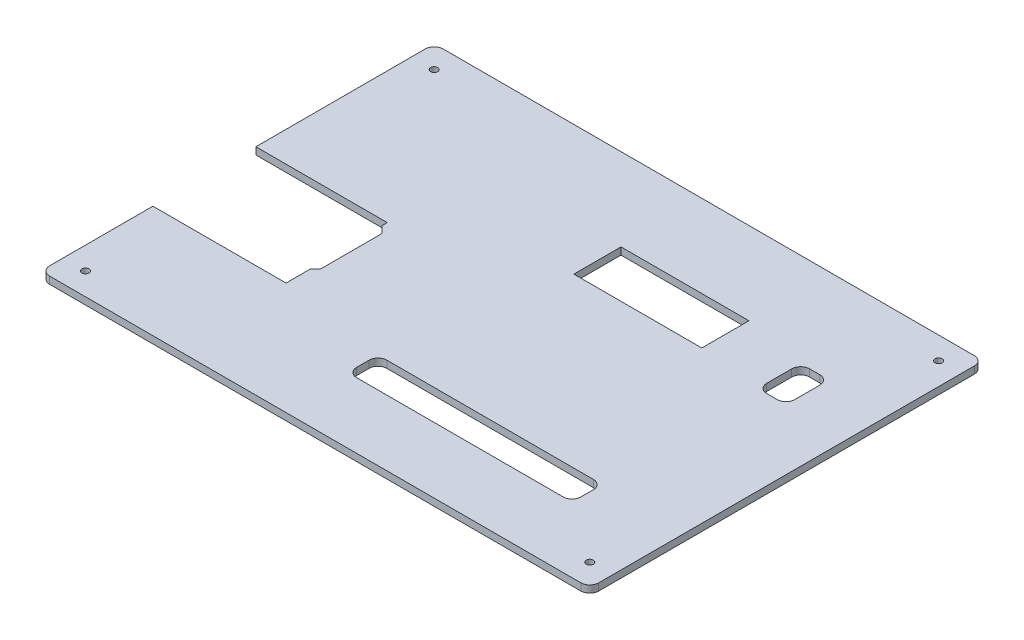
from build123d import *

# Parameters (mm, degrees)
BOSS_EXTRUDE1_DEPTH   = 4
SKETCH4_W             = 71.532637276
SKETCH4_H             = 26.364466528
CUT_EXTRUDE1_DEPTH    = 4
F_4_0MM_DOWEL_HOLE1_D = 4


with BuildPart() as part:
    # Sketch1 → Boss-Extrude1 (new body)
    with BuildSketch(Plane(origin=(0, 0, 0), x_dir=(1, 0, 0), z_dir=(0, 1, 0))):
        with BuildLine():
            Line((-148.5, -110), (148.5, -110))
            ThreePointArc((148.5, -110), (152.035533906, -108.535533906), (153.5, -105))
            Line((153.5, -105), (153.5, 105))
            ThreePointArc((153.5, 105), (152.035533906, 108.535533906), (148.5, 110))
            Line((148.5, 110), (-148.5, 110))
            ThreePointArc((-148.5, 110), (-152.035533906, 108.535533906), (-153.5, 105))
            Line((-153.5, 105), (-153.5, -105))
            ThreePointArc((-153.5, -105), (-152.035533906, -108.535533906), (-148.5, -110))
        make_face()
    extrude(amount=BOSS_EXTRUDE1_DEPTH)

    # Sketch4 → Cut-Extrude1 (cut)
    with BuildSketch(Plane(origin=(0, 4, 0), x_dir=(1, 0, 0), z_dir=(0, 1, 0))):
        Polygon((-153.5, 10.290131999), (-80.023243562, 10.290131999), (-80.023243562, 7.383174491), (-76.226434875, 3.638376882), (-76.226434875, -30.63211249), (-79.068246362, -33.513393581), (-79.068246362, -47.279961532), (-153.5, -47.279961532), align=None)
        with Locations((32.833027244, 50.697784315)):
            Rectangle(SKETCH4_W, SKETCH4_H)
        with BuildLine():
            Line((108.837010637, 57.559292177), (114.585798826, 57.559292177))
            ThreePointArc((114.585798826, 57.559292177), (118.121332732, 56.094826083), (119.585798826, 52.559292177))
            Line((119.585798826, 52.559292177), (119.585798826, 38.593744934))
            ThreePointArc((119.585798826, 38.593744934), (118.121332732, 35.058211028), (114.585798826, 33.593744934))
            Line((114.585798826, 33.593744934), (108.837010637, 33.593744934))
            ThreePointArc((108.837010637, 33.593744934), (105.301476732, 35.058211028), (103.837010637, 38.593744934))
            Line((103.837010637, 38.593744934), (103.837010637, 52.559292177))
            ThreePointArc((103.837010637, 52.559292177), (105.301476732, 56.094826083), (108.837010637, 57.559292177))
        make_face()
        with BuildLine():
            Line((-13.526451363, -56.423479831), (101.946204315, -56.423479831))
            ThreePointArc((101.946204315, -56.423479831), (105.481738221, -57.887945925), (106.946204315, -61.423479831))
            Line((106.946204315, -61.423479831), (106.946204315, -68.367080563))
            ThreePointArc((106.946204315, -68.367080563), (105.481738221, -71.902614469), (101.946204315, -73.367080563))
            Line((101.946204315, -73.367080563), (-13.526451363, -73.367080563))
            ThreePointArc((-13.526451363, -73.367080563), (-17.061985269, -71.902614469), (-18.526451363, -68.367080563))
            Line((-18.526451363, -68.367080563), (-18.526451363, -61.423479831))
            ThreePointArc((-18.526451363, -61.423479831), (-17.061985269, -57.887945925), (-13.526451363, -56.423479831))
        make_face()
    extrude(amount=-CUT_EXTRUDE1_DEPTH, mode=Mode.SUBTRACT)

    # Ø4.0mm Dowel Hole1 (through all)
    with Locations(Plane(origin=(0, 4, 0), x_dir=(1, 0, 0), z_dir=(0, 1, 0))):
        with Locations((-141, -97.5000082), (140.9999974, -97.5000082), (141, 97.5), (-141, 97.5)):
            Hole(F_4_0MM_DOWEL_HOLE1_D / 2)


solid = part.part
